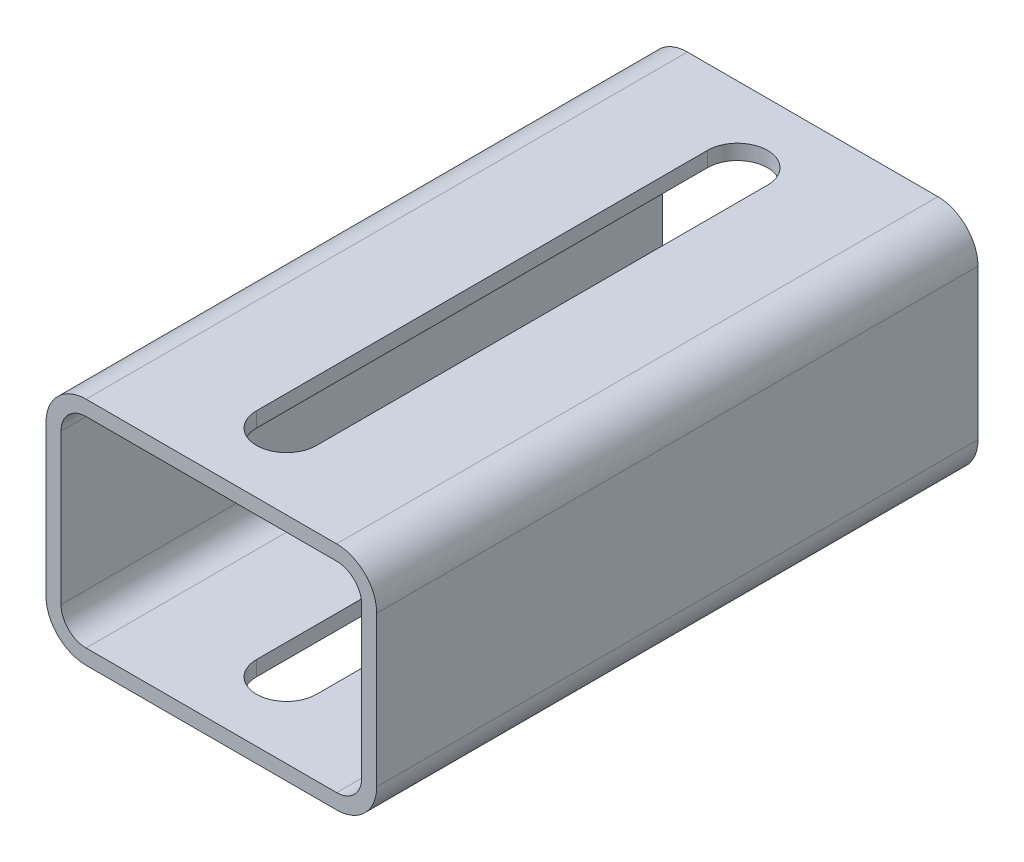
from build123d import *

# Parameters (mm, degrees)
EXTRUDE_THIN1_DEPTH = 60
CUT_EXTRUDE1_DEPTH  = 83.492423895


with BuildPart() as part:
    # Sketch1 → Extrude-Thin1 (new, symmetric)
    with BuildSketch(Plane.XY):
        with BuildLine():
            Line((-25, 23), (25, 23))
            ThreePointArc((25, 23), (30.656854249, 20.656854249), (33, 15))
            Line((33, 15), (33, -15))
            ThreePointArc((33, -15), (30.656854249, -20.656854249), (25, -23))
            Line((25, -23), (-25, -23))
            ThreePointArc((-25, -23), (-30.656854249, -20.656854249), (-33, -15))
            Line((-33, -15), (-33, 15))
            ThreePointArc((-33, 15), (-30.656854249, 20.656854249), (-25, 23))
        make_face()
        with BuildLine():
            Line((-25, 20), (25, 20))
            ThreePointArc((25, 20), (28.535533906, 18.535533906), (30, 15))
            Line((30, 15), (30, -15))
            ThreePointArc((30, -15), (28.535533906, -18.535533906), (25, -20))
            Line((25, -20), (-25, -20))
            ThreePointArc((-25, -20), (-28.535533906, -18.535533906), (-30, -15))
            Line((-30, -15), (-30, 15))
            ThreePointArc((-30, 15), (-28.535533906, 18.535533906), (-25, 20))
        make_face(mode=Mode.SUBTRACT)
    extrude(amount=EXTRUDE_THIN1_DEPTH, both=True)

    # Sketch3 → Cut-Extrude1 (cut, through all)
    with BuildSketch(Plane(origin=(0, 23, 0), x_dir=(1, 0, 0), z_dir=(0, 1, 0))):
        with BuildLine():
            Line((6, 45), (6, -45))
            ThreePointArc((6, -45), (0, -51), (-6, -45))
            Line((-6, -45), (-6, 45))
            ThreePointArc((-6, 45), (0, 51), (6, 45))
        make_face()
    extrude(amount=-CUT_EXTRUDE1_DEPTH, mode=Mode.SUBTRACT)


solid = part.part
